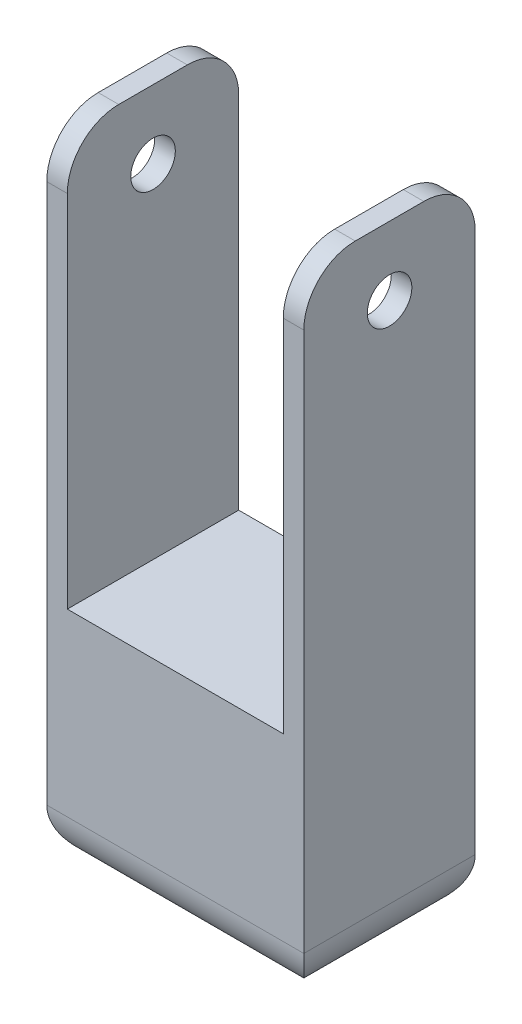
from build123d import *

# Parameters (mm, degrees)
SKETCH1_W           = 38.1
SKETCH1_H           = 25.4
BOSS_EXTRUDE1_DEPTH = 63.5
SKETCH2_W           = 32.004
SKETCH2_H           = 25.4
CUT_EXTRUDE1_DEPTH  = 60.96
SKETCH3_R           = 3.302
CUT_EXTRUDE2_DEPTH  = 76.134213245
FILLET1_R           = 7.62
SKETCH4_W           = 38.1
SKETCH4_H           = 25.4
BOSS_EXTRUDE2_DEPTH = 31.75
FILLET2_R           = 7.62


with BuildPart() as part:
    # Sketch1 → Boss-Extrude1 (new body)
    with BuildSketch(Plane(origin=(0, 0, 0), x_dir=(1, 0, 0), z_dir=(0, 1, 0))):
        Rectangle(SKETCH1_W, SKETCH1_H)
    extrude(amount=BOSS_EXTRUDE1_DEPTH)

    # Sketch2 → Cut-Extrude1 (cut)
    with BuildSketch(Plane(origin=(0, 63.5, 0), x_dir=(1, 0, 0), z_dir=(0, 1, 0))):
        Rectangle(SKETCH2_W, SKETCH2_H)
    extrude(amount=-CUT_EXTRUDE1_DEPTH, mode=Mode.SUBTRACT)

    # Sketch3 → Cut-Extrude2 (cut, through all)
    with BuildSketch(Plane.ZY.offset(19.05)):
        with Locations((0, 53.34)):
            Circle(SKETCH3_R)
    extrude(amount=-CUT_EXTRUDE2_DEPTH, mode=Mode.SUBTRACT)

    # Fillet1
    fillet1_edges = [part.edges().sort_by_distance(p)[0] for p in [
        (-17.526, 63.5, -12.7),
        (17.526, 63.5, 12.7),
        (-17.526, 63.5, 12.7),
        (17.526, 63.5, -12.7),
    ]]
    fillet(fillet1_edges, radius=FILLET1_R)

    # Sketch4 → Boss-Extrude2 (add)
    with BuildSketch(Plane.XZ):
        Rectangle(SKETCH4_W, SKETCH4_H)
    extrude(amount=BOSS_EXTRUDE2_DEPTH)

    # Fillet2
    fillet2_edges = [part.edges().sort_by_distance(p)[0] for p in [
        (-19.05, -31.75, 0),
        (0, -31.75, -12.7),
        (19.05, -31.75, 0),
        (0, -31.75, 12.7),
    ]]
    fillet(fillet2_edges, radius=FILLET2_R)


solid = part.part
